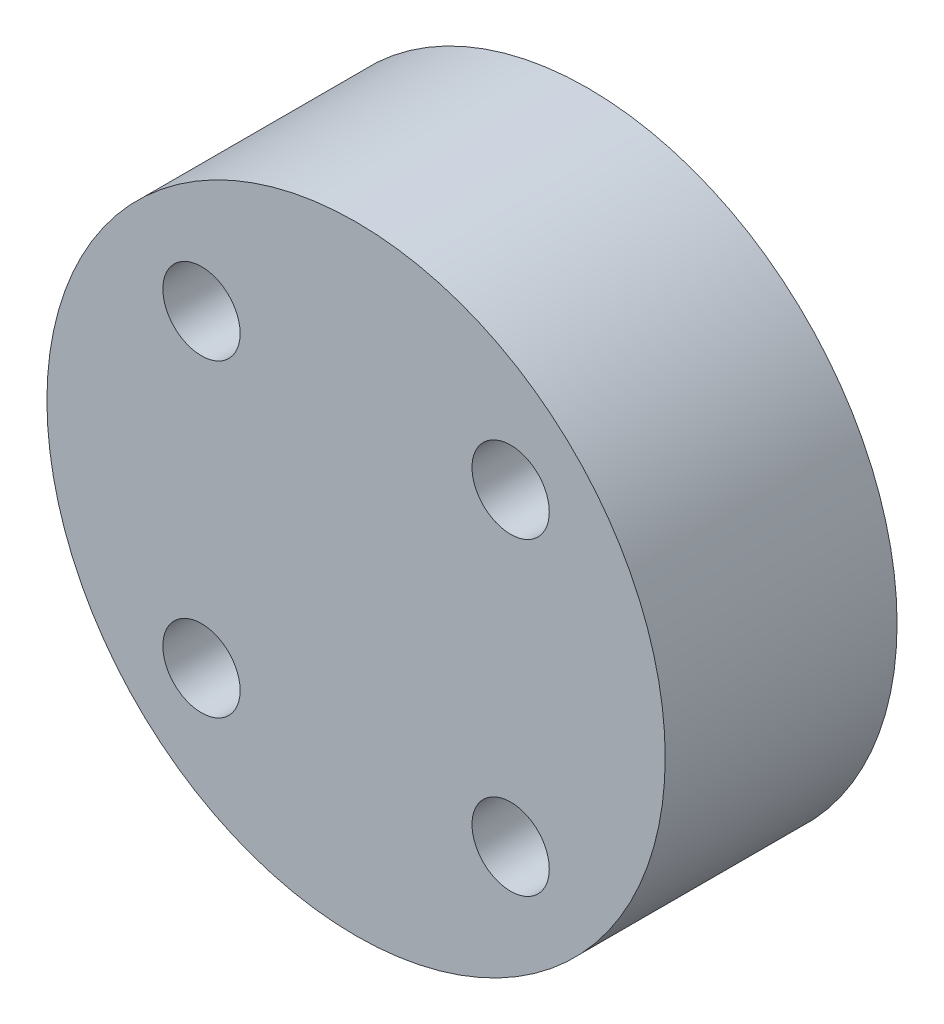
from build123d import *

# Parameters (mm, degrees)
SKETCH_1_R          = 20
EXTRUDE_1_DEPTH     = 15
SKETCH_2_R          = 2.5
CUT_EXTRUDE_1_DEPTH = 33.015621187


with BuildPart() as part:
    # 草图1 → 凸台-拉伸1 (new body)
    with BuildSketch(Plane.XY):
        Circle(SKETCH_1_R)
    extrude(amount=EXTRUDE_1_DEPTH)

    # 草图2 → 切除-拉伸1 (cut, through all)
    with BuildSketch(Plane.XY.offset(15)):
        with Locations((-10, 10)):
            Circle(SKETCH_2_R)
        with Locations((10, 10)):
            Circle(SKETCH_2_R)
        with Locations((10, -10)):
            Circle(SKETCH_2_R)
        with Locations((-10, -10)):
            Circle(SKETCH_2_R)
    extrude(amount=-CUT_EXTRUDE_1_DEPTH, mode=Mode.SUBTRACT)


solid = part.part
